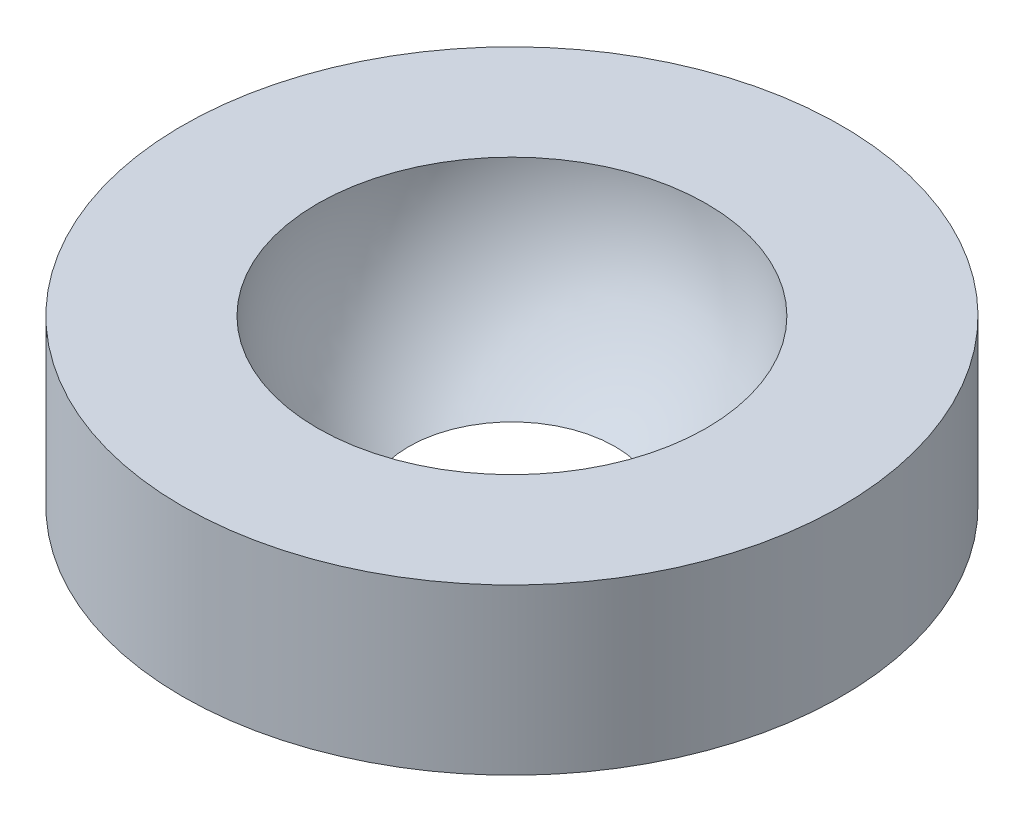
from build123d import *


with BuildPart() as part:
    # Sketch1 → Revolve1 (revolve)
    with BuildSketch(Plane.XY, mode=Mode.PRIVATE) as revolve1_sk:
        with BuildLine():
            ThreePointArc((3.97775678, -6.35), (6.555546528, -3.629029998), (7.493, 0))
            Line((7.493, 0), (12.7, 0))
            Line((12.7, 0), (12.7, -6.35))
            Line((12.7, -6.35), (3.97775678, -6.35))
        make_face()
    revolve(revolve1_sk.sketch.rotate(Axis((0, 12.116938578, 0), (0, -1, 0)), 90), axis=Axis((0, 12.116938578, 0), (0, -1, 0)))


solid = part.part
